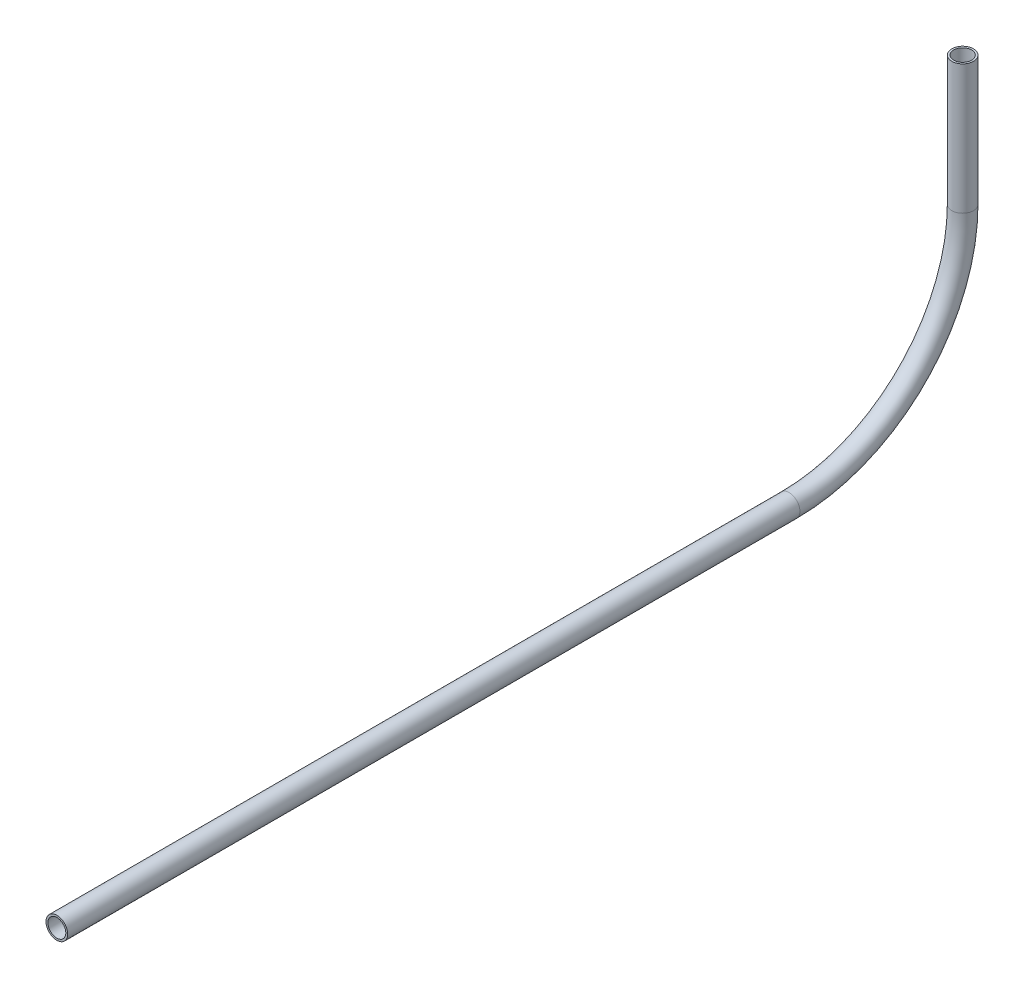
from build123d import *

# Parameters (mm, degrees)
SKETCH11_R                = 3.175
SKETCH11_R_2              = 2.6162
PIPE_0_5_SCH_40_1_DEPTH   = 214.302062458
SKETCH11_ON_SEGMENT_2_R   = 3.175
SKETCH11_ON_SEGMENT_2_R_2 = 2.6162
PIPE_0_5_SCH_40_1_2_ANGLE = 90
SKETCH11_ON_SEGMENT_3_R   = 3.175
SKETCH11_ON_SEGMENT_3_R_2 = 2.6162
PIPE_0_5_SCH_40_1_3_DEPTH = 37.855004884


with BuildPart() as part:
    # Sketch11 → Pipe 0.5 SCH 40(1) (new body)
    with BuildSketch(Plane(origin=(0, 163.431959968, 271.492619127), x_dir=(0, 1, 0), z_dir=(0, 0, -1))):
        Circle(SKETCH11_R)
        Circle(SKETCH11_R_2, mode=Mode.SUBTRACT)
    extrude(amount=PIPE_0_5_SCH_40_1_DEPTH)


with BuildPart() as body_2:
    # Sketch11 on segment 2 (carried to the start of arc 2) → Pipe 0.5 SCH 40_1 2 (revolve)
    with BuildSketch(Plane(origin=(0, 163.431959968, 57.19055667), x_dir=(0, 1, 0), z_dir=(0, 0, -1))):
        Circle(SKETCH11_ON_SEGMENT_2_R)
        Circle(SKETCH11_ON_SEGMENT_2_R_2, mode=Mode.SUBTRACT)
    revolve(axis=Axis((0, 214.231959968, 57.19055667), (1, 0, 0)), revolution_arc=PIPE_0_5_SCH_40_1_2_ANGLE)


with BuildPart() as body_3:
    # Sketch11 on segment 3 (carried to segment 3) → Pipe 0.5 SCH 40_1 3 (new body)
    with BuildSketch(Plane(origin=(0, 214.231959968, 6.39055667), x_dir=(0, 0, 1), z_dir=(0, 1, 0))):
        Circle(SKETCH11_ON_SEGMENT_3_R)
        Circle(SKETCH11_ON_SEGMENT_3_R_2, mode=Mode.SUBTRACT)
    extrude(amount=PIPE_0_5_SCH_40_1_3_DEPTH)


solid = Compound([part.part, body_2.part, body_3.part])
